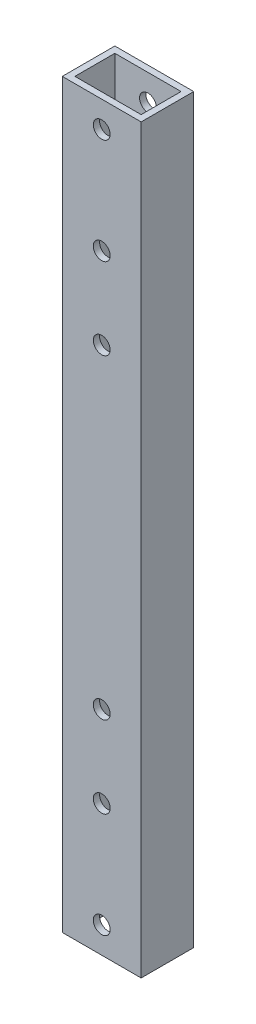
from build123d import *

# Parameters (mm, degrees)
SKETCH_1_W          = 15
SKETCH_1_H          = 10
SKETCH_1_W_2        = 12.6
SKETCH_1_H_2        = 7.6
EXTRUDE_1_DEPTH     = 70.5
SKETCH_2_R          = 1.6
CUT_EXTRUDE_1_DEPTH = 100
SKETCH_3_R          = 1.6
CUT_EXTRUDE_2_DEPTH = 10


with BuildPart() as part:
    # ｽｹｯﾁ1 → ﾎﾞｽ - 押し出し1 (new, symmetric)
    with BuildSketch(Plane(origin=(0, 0, 0), x_dir=(1, 0, 0), z_dir=(0, 1, 0))):
        Rectangle(SKETCH_1_W, SKETCH_1_H)
        Rectangle(SKETCH_1_W_2, SKETCH_1_H_2, mode=Mode.SUBTRACT)
    extrude(amount=EXTRUDE_1_DEPTH, both=True)

    # ｽｹｯﾁ2 → ｶｯﾄ - 押し出し1 (cut)
    with BuildSketch(Plane(origin=(0, 0, -5), x_dir=(-1, 0, 0), z_dir=(0, 0, -1))):
        with Locations((0, -65.5)):
            Circle(SKETCH_2_R)
        with Locations((0, -45.5)):
            Circle(SKETCH_2_R)
        with Locations(Location((0, 45.5, 0), (0, 0, 180))):
            Circle(SKETCH_2_R)
        with Locations(Location((0, 65.5, 0), (0, 0, 180))):
            Circle(SKETCH_2_R)
    extrude(amount=-CUT_EXTRUDE_1_DEPTH, mode=Mode.SUBTRACT)

    # ｽｹｯﾁ3 → ｶｯﾄ - 押し出し2 (cut)
    with BuildSketch(Plane(origin=(0, 0, -5), x_dir=(-1, 0, 0), z_dir=(0, 0, -1))):
        with Locations((0, -30)):
            Circle(SKETCH_3_R)
        with Locations((0, 30)):
            Circle(SKETCH_3_R)
    extrude(amount=-CUT_EXTRUDE_2_DEPTH, mode=Mode.SUBTRACT)


solid = part.part
